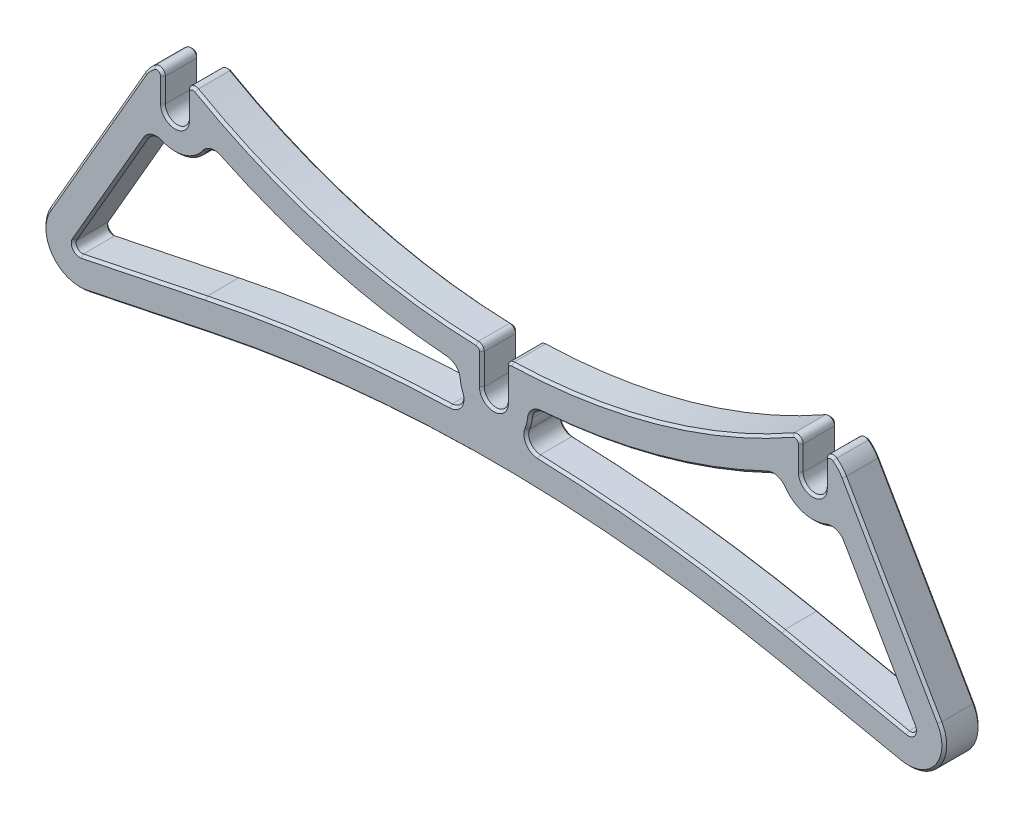
from build123d import *

# Parameters (mm, degrees)
SKETCH1_R               = 2
BOSS_EXTRUDE1_DEPTH     = 6
CUT_EXTRUDE1_DEPTH      = 146.745632929
CUT_EXTRUDE1_DEPTH_BACK = 146.745632929
SKETCH2_W               = 4
SKETCH2_H               = 8
FILLET1_R               = 1
CHAMFER1_SIZE           = 0.4


with BuildPart() as part:
    # Sketch1 → Boss-Extrude1 (new body)
    with BuildSketch(Plane.XY):
        with BuildLine():
            Line((-67.487193618, -124.875178462), (-46.894125327, -120.607763904))
            ThreePointArc((-46.894125327, -120.607763904), (0, -115.8), (46.894125327, -120.607763904))
            Line((46.894125327, -120.607763904), (67.487193618, -124.875178462))
            ThreePointArc((67.487193618, -124.875178462), (73.567771587, -122.514307898), (73.900834456, -116))
            Line((73.900834456, -116), (58.096152423, -88.62548772))
            ThreePointArc((58.096152423, -88.62548772), (54.452914271, -85.829932763), (49.9, -86.429335298))
            ThreePointArc((49.9, -86.429335298), (0, -99.8), (-49.9, -86.429335298))
            ThreePointArc((-49.9, -86.429335298), (-54.452914271, -85.829932763), (-58.096152423, -88.62548772))
            Line((-58.096152423, -88.62548772), (-73.900834456, -116))
            ThreePointArc((-73.900834456, -116), (-73.567771587, -122.514307898), (-67.487193618, -124.875178462))
        make_face()
        with Locations((-52.9, -91.62548772)):
            Circle(SKETCH1_R, mode=Mode.SUBTRACT)
        with Locations((0, -105.8)):
            Circle(SKETCH1_R, mode=Mode.SUBTRACT)
        with Locations((52.9, -91.62548772)):
            Circle(SKETCH1_R, mode=Mode.SUBTRACT)
        with BuildLine():
            Line((-69.570707437, -118.5), (-57.73465237, -97.999351263))
            ThreePointArc((-57.73465237, -97.999351263), (-56.640201841, -97.103707339), (-55.226951172, -97.155885377))
            ThreePointArc((-55.226951172, -97.155885377), (-51.238896905, -97.390965715), (-47.987257609, -95.070043164))
            ThreePointArc((-47.987257609, -95.070043164), (-46.854543749, -94.282999804), (-45.481705336, -94.41638883))
            ThreePointArc((-45.481705336, -94.41638883), (-27.124235927, -101.229026595), (-7.819882186, -104.507843929))
            ThreePointArc((-7.819882186, -104.507843929), (-6.564274733, -105.07874485), (-5.976837434, -106.326701323))
            ThreePointArc((-5.976837434, -106.326701323), (-5.822477821, -107.248707019), (-5.526774098, -108.13554449))
            ThreePointArc((-5.526774098, -108.13554449), (-5.685239419, -109.993337832), (-7.307134178, -110.913101252))
            ThreePointArc((-7.307134178, -110.913101252), (-27.711981027, -112.431953925), (-47.908699007, -115.711781853))
            Line((-47.908699007, -115.711781853), (-68.501767298, -119.97919641))
            ThreePointArc((-68.501767298, -119.97919641), (-69.515196959, -119.585717983), (-69.570707437, -118.5))
        make_face(mode=Mode.SUBTRACT)
        with BuildLine():
            Line((69.570707437, -118.5), (57.73465237, -97.999351263))
            ThreePointArc((57.73465237, -97.999351263), (56.640201841, -97.103707339), (55.226951172, -97.155885377))
            ThreePointArc((55.226951172, -97.155885377), (51.238896905, -97.390965715), (47.987257609, -95.070043164))
            ThreePointArc((47.987257609, -95.070043164), (46.854543749, -94.282999804), (45.481705336, -94.41638883))
            ThreePointArc((45.481705336, -94.41638883), (27.124235927, -101.229026595), (7.819882186, -104.507843929))
            ThreePointArc((7.819882186, -104.507843929), (6.564274733, -105.07874485), (5.976837434, -106.326701323))
            ThreePointArc((5.976837434, -106.326701323), (5.822477821, -107.248707019), (5.526774098, -108.13554449))
            ThreePointArc((5.526774098, -108.13554449), (5.685239419, -109.993337832), (7.307134178, -110.913101252))
            ThreePointArc((7.307134178, -110.913101252), (27.711981027, -112.431953925), (47.908699007, -115.711781853))
            Line((47.908699007, -115.711781853), (68.501767298, -119.97919641))
            ThreePointArc((68.501767298, -119.97919641), (69.515196959, -119.585717983), (69.570707437, -118.5))
        make_face(mode=Mode.SUBTRACT)
    extrude(amount=BOSS_EXTRUDE1_DEPTH)

    # Sketch2 → Cut-Extrude1 (cut, two sides: drawn at the far end of the back side and taken through both)
    with BuildSketch(Plane.XY.offset(6).offset(-CUT_EXTRUDE1_DEPTH_BACK)):
        with Locations((-52.9, -87.62548772)):
            Rectangle(SKETCH2_W, SKETCH2_H)
        with Locations((0, -101.8)):
            Rectangle(SKETCH2_W, SKETCH2_H)
        with Locations((52.9, -87.62548772)):
            Rectangle(SKETCH2_W, SKETCH2_H)
    extrude(amount=CUT_EXTRUDE1_DEPTH + CUT_EXTRUDE1_DEPTH_BACK, mode=Mode.SUBTRACT)

    # Fillet1
    fillet1_edges = [part.edges().sort_by_distance(p)[0] for p in [
        (-2, -99.779957907, 3),
        (2, -99.779957907, 3),
        (50.9, -85.968633471, 3),
        (54.9, -85.968633471, 3),
        (-54.9, -85.968633471, 3),
        (-50.9, -85.968633471, 3),
    ]]
    fillet(fillet1_edges, radius=FILLET1_R)

    # Chamfer1
    chamfer1_edges = [part.edges().sort_by_distance(p)[0] for p in [
        (5.685239419, -109.993337832, 0),
        (5.822477821, -107.248707019, 0),
        (6.564274733, -105.07874485, 0),
        (27.124235927, -101.229026595, 0),
        (46.854543749, -94.282999804, 0),
        (51.238896905, -97.390965715, 0),
        (56.640201841, -97.103707339, 0),
        (63.652679904, -108.249675631, 0),
        (69.515196959, -119.585717983, 0),
        (58.205233152, -117.845489132, 0),
        (27.711981027, -112.431953925, 0),
        (52.9, -93.62548772, 0),
        (0, -107.8, 0),
        (-52.9, -93.62548772, 0),
        (-57.190659472, -122.741471183, 0),
        (0, -115.8, 0),
        (57.190659472, -122.741471183, 0),
        (73.567771587, -122.514307898, 0),
        (65.998493439, -102.31274386, 0),
        (57.389217567, -87.644668001, 0),
        (-26.987353233, -96.081854507, 0),
        (26.987353233, -96.081854507, 0),
        (-57.389217567, -87.644668001, 0),
        (-65.998493439, -102.31274386, 0),
        (-73.567771587, -122.514307898, 0),
        (-63.652679904, -108.249675631, 0),
        (-56.640201841, -97.103707339, 0),
        (-51.238896905, -97.390965715, 0),
        (-46.854543749, -94.282999804, 0),
        (-27.124235927, -101.229026595, 0),
        (-6.564274733, -105.07874485, 0),
        (-5.822477821, -107.248707019, 0),
        (-5.685239419, -109.993337832, 0),
        (-27.711981027, -112.431953925, 0),
        (-58.205233152, -117.845489132, 0),
        (-69.515196959, -119.585717983, 0),
        (69.515196959, -119.585717983, 6),
        (63.652679904, -108.249675631, 6),
        (56.640201841, -97.103707339, 6),
        (51.238896905, -97.390965715, 6),
        (46.854543749, -94.282999804, 6),
        (27.124235927, -101.229026595, 6),
        (6.564274733, -105.07874485, 6),
        (5.822477821, -107.248707019, 6),
        (5.685239419, -109.993337832, 6),
        (27.711981027, -112.431953925, 6),
        (58.205233152, -117.845489132, 6),
        (-27.711981027, -112.431953925, 6),
        (-5.685239419, -109.993337832, 6),
        (-5.822477821, -107.248707019, 6),
        (-6.564274733, -105.07874485, 6),
        (-27.124235927, -101.229026595, 6),
        (-46.854543749, -94.282999804, 6),
        (-51.238896905, -97.390965715, 6),
        (-56.640201841, -97.103707339, 6),
        (-63.652679904, -108.249675631, 6),
        (-69.515196959, -119.585717983, 6),
        (-58.205233152, -117.845489132, 6),
        (52.9, -93.62548772, 6),
        (-52.9, -93.62548772, 6),
        (-65.998493439, -102.31274386, 6),
        (-57.389217567, -87.644668001, 6),
        (-26.987353233, -96.081854507, 6),
        (26.987353233, -96.081854507, 6),
        (57.389217567, -87.644668001, 6),
        (65.998493439, -102.31274386, 6),
        (73.567771587, -122.514307898, 6),
        (57.190659472, -122.741471183, 6),
        (0, -115.8, 6),
        (-57.190659472, -122.741471183, 6),
        (-73.567771587, -122.514307898, 6),
        (0, -107.8, 6),
        (-50.402474038, -86.717540583, 0),
        (-50.9, -89.603810301, 0),
        (-54.9, -89.62548772, 0),
        (-55.452786405, -86.731060529, 0),
        (55.452786405, -86.731060529, 0),
        (54.9, -89.62548772, 0),
        (50.9, -89.603810301, 0),
        (50.402474038, -86.717540583, 0),
        (2.282447944, -100.058842373, 0),
        (2, -103.277673626, 0),
        (-2, -103.277673626, 0),
        (-2.282447944, -100.058842373, 0),
        (2, -103.277673626, 6),
        (2.282447944, -100.058842373, 6),
        (50.402474038, -86.717540583, 6),
        (50.9, -89.603810301, 6),
        (54.9, -89.62548772, 6),
        (55.452786405, -86.731060529, 6),
        (-55.452786405, -86.731060529, 6),
        (-54.9, -89.62548772, 6),
        (-50.9, -89.603810301, 6),
        (-50.402474038, -86.717540583, 6),
        (-2.282447944, -100.058842373, 6),
        (-2, -103.277673626, 6),
    ]]
    chamfer(chamfer1_edges, length=CHAMFER1_SIZE)


solid = part.part
